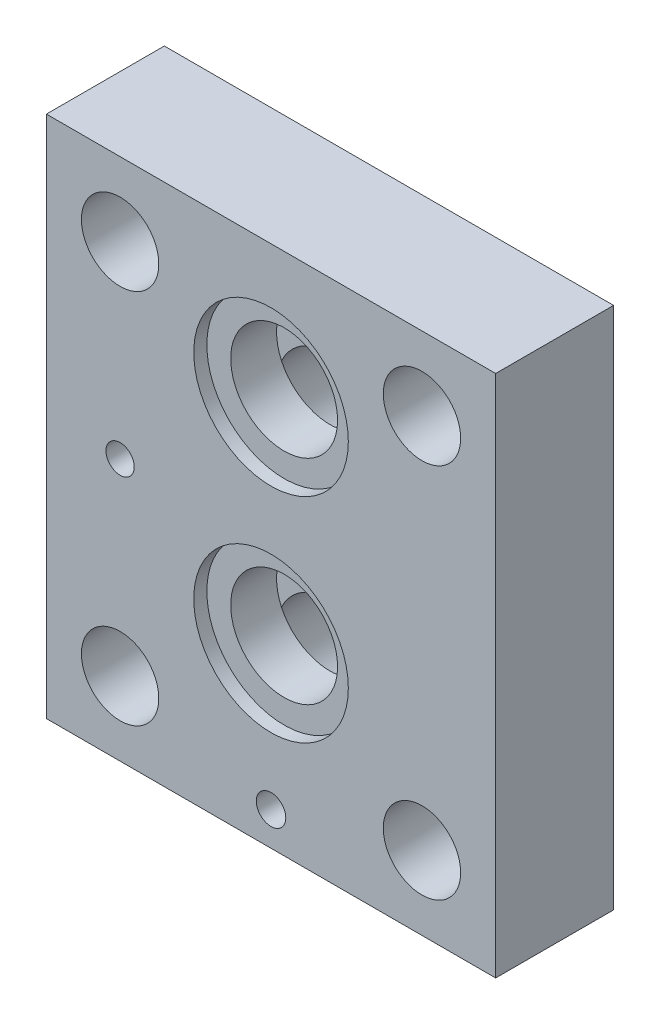
from build123d import *

# Parameters (mm, degrees)
SKETCH1_W           = 112.776
SKETCH1_H           = 96.774
BOSS_EXTRUDE1_DEPTH = 12.7
CUT_EXTRUDE2_START  = -12.7
SKETCH2_R           = 8.334375
CUT_EXTRUDE2_DEPTH  = 25.4
CUT_EXTRUDE4_START  = -12.7
SKETCH3_R           = 8.334375
CUT_EXTRUDE4_DEPTH  = 25.4
CUT_EXTRUDE6_START  = -12.7
SKETCH4_R           = 11.509375
CUT_EXTRUDE6_DEPTH  = 12.7
CUT_EXTRUDE8_START  = -12.7
SKETCH5_R           = 11.509375
CUT_EXTRUDE8_DEPTH  = 12.7
CUT_EXTRUDE10_START = 12.7
SKETCH6_R           = 11.509375
CUT_EXTRUDE10_DEPTH = 12.7
CUT_EXTRUDE12_START = 12.7
SKETCH7_R           = 11.509375
CUT_EXTRUDE12_DEPTH = 12.7
CUT_EXTRUDE14_START = 12.7
SKETCH8_R           = 16.6497
CUT_EXTRUDE14_DEPTH = 2.8194
CUT_EXTRUDE16_START = 12.7
SKETCH9_R           = 16.6497
CUT_EXTRUDE16_DEPTH = 2.8194
CUT_EXTRUDE18_START = -12.7
SKETCH10_R          = 3.571875
CUT_EXTRUDE18_DEPTH = 7.874
CUT_EXTRUDE20_START = -12.7
SKETCH11_R          = 3.698875
CUT_EXTRUDE20_DEPTH = 7.874
CUT_EXTRUDE22_START = 12.7
SKETCH12_R          = 3.175
CUT_EXTRUDE22_DEPTH = 7.874
CUT_EXTRUDE24_START = 12.7
SKETCH13_R          = 3.048
CUT_EXTRUDE24_DEPTH = 7.874


with BuildPart() as part:
    # Sketch1 → Boss-Extrude1 (new, symmetric)
    with BuildSketch(Plane(origin=(0, 0, 0), x_dir=(0, 1, 0), z_dir=(0, 0, 1))):
        Rectangle(SKETCH1_W, SKETCH1_H)
    extrude(amount=BOSS_EXTRUDE1_DEPTH, both=True)

    # Sketch2 → Cut-Extrude2 (cut)
    with BuildSketch(Plane(origin=(0, 0, 0), x_dir=(0, 1, 0), z_dir=(0, 0, 1)).offset(CUT_EXTRUDE2_START)):
        with Locations(Location((-40.513, -32.512, 0), (0, 0, 90))):
            Circle(SKETCH2_R)
    extrude(amount=CUT_EXTRUDE2_DEPTH, mode=Mode.SUBTRACT)

    # Sketch3 → Cut-Extrude4 (cut)
    with BuildSketch(Plane(origin=(0, 0, 0), x_dir=(0, 1, 0), z_dir=(0, 0, 1)).offset(CUT_EXTRUDE4_START)):
        with Locations(Location((40.513, -32.512, 0), (0, 0, 90))):
            Circle(SKETCH3_R)
        with Locations(Location((-40.513, 32.512, 0), (0, 0, 90))):
            Circle(SKETCH3_R)
        with Locations(Location((40.513, 32.512, 0), (0, 0, 90))):
            Circle(SKETCH3_R)
    extrude(amount=CUT_EXTRUDE4_DEPTH, mode=Mode.SUBTRACT)

    # Sketch4 → Cut-Extrude6 (cut)
    with BuildSketch(Plane(origin=(0, 0, 0), x_dir=(0, 1, 0), z_dir=(0, 0, 1)).offset(CUT_EXTRUDE6_START)):
        with Locations(Location((-27.813, 0, 0), (0, 0, 270))):
            Circle(SKETCH4_R)
    extrude(amount=CUT_EXTRUDE6_DEPTH, mode=Mode.SUBTRACT)

    # Sketch5 → Cut-Extrude8 (cut)
    with BuildSketch(Plane(origin=(0, 0, 0), x_dir=(0, 1, 0), z_dir=(0, 0, 1)).offset(CUT_EXTRUDE8_START)):
        with Locations(Location((18.161, 0, 0), (0, 0, 270))):
            Circle(SKETCH5_R)
    extrude(amount=CUT_EXTRUDE8_DEPTH, mode=Mode.SUBTRACT)

    # Sketch6 → Cut-Extrude10 (cut)
    with BuildSketch(Plane(origin=(0, 0, 0), x_dir=(0, 1, 0), z_dir=(0, 0, 1)).offset(CUT_EXTRUDE10_START)):
        with Locations(Location((-18.161, 0, 0), (0, 0, 270))):
            Circle(SKETCH6_R)
    extrude(amount=-CUT_EXTRUDE10_DEPTH, mode=Mode.SUBTRACT)

    # Sketch7 → Cut-Extrude12 (cut)
    with BuildSketch(Plane(origin=(0, 0, 0), x_dir=(0, 1, 0), z_dir=(0, 0, 1)).offset(CUT_EXTRUDE12_START)):
        with Locations(Location((27.813, 0, 0), (0, 0, 270))):
            Circle(SKETCH7_R)
    extrude(amount=-CUT_EXTRUDE12_DEPTH, mode=Mode.SUBTRACT)

    # Sketch8 → Cut-Extrude14 (cut)
    with BuildSketch(Plane(origin=(0, 0, 0), x_dir=(0, 1, 0), z_dir=(0, 0, 1)).offset(CUT_EXTRUDE14_START)):
        with Locations(Location((-18.161, 0, 0), (0, 0, 270))):
            Circle(SKETCH8_R)
    extrude(amount=-CUT_EXTRUDE14_DEPTH, mode=Mode.SUBTRACT)

    # Sketch9 → Cut-Extrude16 (cut)
    with BuildSketch(Plane(origin=(0, 0, 0), x_dir=(0, 1, 0), z_dir=(0, 0, 1)).offset(CUT_EXTRUDE16_START)):
        with Locations(Location((27.813, 0, 0), (0, 0, 270))):
            Circle(SKETCH9_R)
    extrude(amount=-CUT_EXTRUDE16_DEPTH, mode=Mode.SUBTRACT)

    # Sketch10 → Cut-Extrude18 (cut)
    with BuildSketch(Plane(origin=(0, 0, 0), x_dir=(0, 1, 0), z_dir=(0, 0, 1)).offset(CUT_EXTRUDE18_START)):
        with Locations(Location((49.149, 0, 0), (0, 0, 270))):
            Circle(SKETCH10_R)
    extrude(amount=CUT_EXTRUDE18_DEPTH, mode=Mode.SUBTRACT)

    # Sketch11 → Cut-Extrude20 (cut)
    with BuildSketch(Plane(origin=(0, 0, 0), x_dir=(0, 1, 0), z_dir=(0, 0, 1)).offset(CUT_EXTRUDE20_START)):
        with Locations(Location((0, -32.512, 0), (0, 0, 270))):
            Circle(SKETCH11_R)
    extrude(amount=CUT_EXTRUDE20_DEPTH, mode=Mode.SUBTRACT)

    # Sketch12 → Cut-Extrude22 (cut)
    with BuildSketch(Plane(origin=(0, 0, 0), x_dir=(0, 1, 0), z_dir=(0, 0, 1)).offset(CUT_EXTRUDE22_START)):
        with Locations(Location((-49.149, 0, 0), (0, 0, 270))):
            Circle(SKETCH12_R)
    extrude(amount=-CUT_EXTRUDE22_DEPTH, mode=Mode.SUBTRACT)

    # Sketch13 → Cut-Extrude24 (cut)
    with BuildSketch(Plane(origin=(0, 0, 0), x_dir=(0, 1, 0), z_dir=(0, 0, 1)).offset(CUT_EXTRUDE24_START)):
        with Locations(Location((0, 32.512, 0), (0, 0, 270))):
            Circle(SKETCH13_R)
    extrude(amount=-CUT_EXTRUDE24_DEPTH, mode=Mode.SUBTRACT)


solid = part.part
